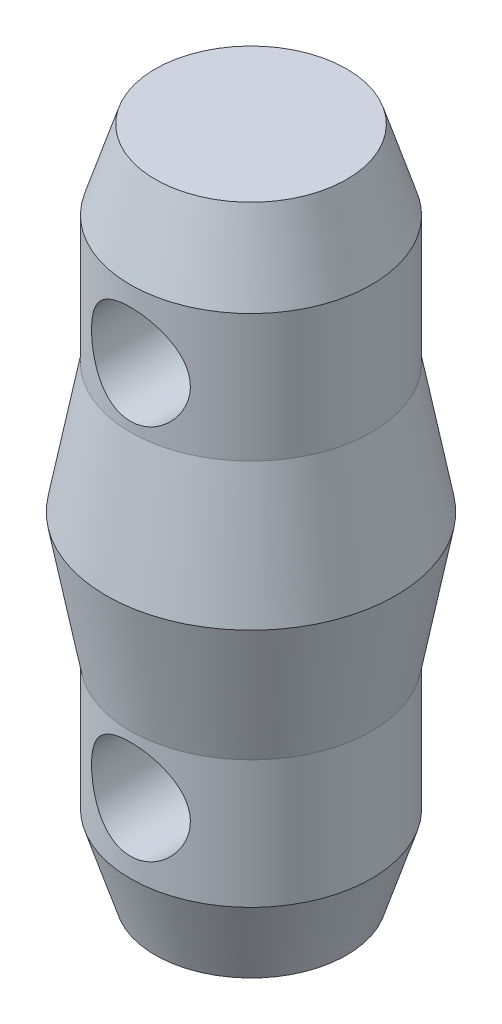
from build123d import *

# Parameters (mm, degrees)
SKETCH2_R          = 5.8928
CUT_EXTRUDE1_DEPTH = 47.926843706


with BuildPart() as part:
    # Sketch1 → Revolve1 (revolve)
    with BuildSketch(Plane.XY, mode=Mode.PRIVATE) as revolve1_sk:
        Polygon((0, 0), (0, 40.0685), (11.4173, 40.0685), (14.3891, 30.672044722), (14.3891, 15.432044722), (17.272, 0), align=None)
    revolve1 = revolve(revolve1_sk.sketch.rotate(Axis((0, 0, 0), (0, 1, 0)), 90), axis=Axis((0, 0, 0), (0, 1, 0)))

    # Sketch2 → Cut-Extrude1 (cut, symmetric)
    with BuildSketch(Plane.XY):
        with Locations((0, 22.4663)):
            Circle(SKETCH2_R)
    cut_extrude1 = extrude(amount=CUT_EXTRUDE1_DEPTH, both=True, mode=Mode.SUBTRACT)

    # Mirror1: Revolve1, Cut-Extrude1 across plane
    add(revolve1.mirror(Plane(origin=(17.272, 0, 0), x_dir=(0, 0, 1), z_dir=(0, -1, 0))))
    add(cut_extrude1.mirror(Plane(origin=(17.272, 0, 0), x_dir=(0, 0, 1), z_dir=(0, -1, 0))), mode=Mode.SUBTRACT)


solid = part.part
